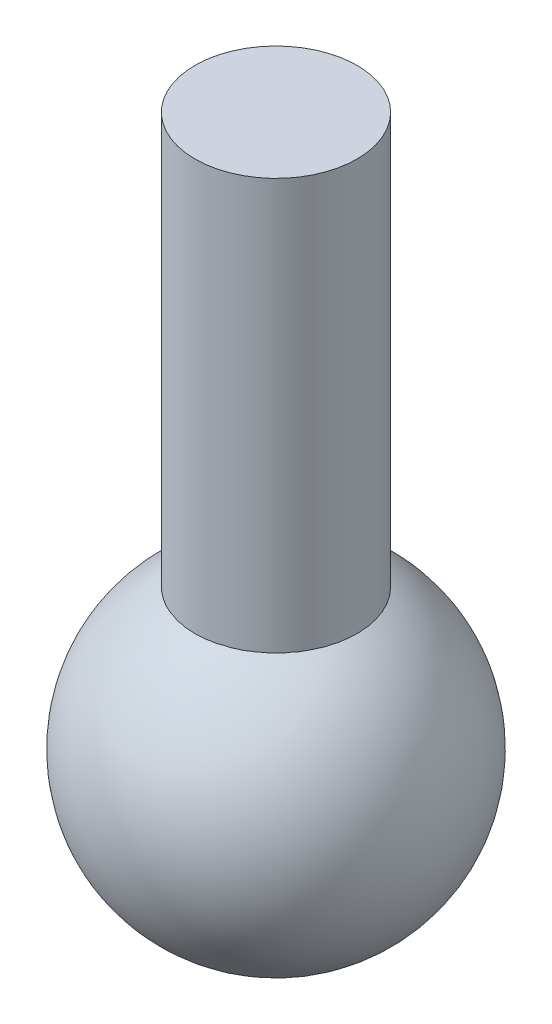
from build123d import *

# Parameters (mm, degrees)
BOSS_EXTRUDE1_DEPTH = 8
SKETCH2_R           = 5
CUT_EXTRUDE1_DEPTH  = 107
CIRPATTERN1_COUNT   = 3
SKETCH6_R           = 5
BOSS_EXTRUDE3_DEPTH = 34
CUT_EXTRUDE2_START  = -10
SKETCH9_R           = 54.22089026
SKETCH9_R_2         = 5
CUT_EXTRUDE2_DEPTH  = 10


with BuildPart() as part:
    # Sketch1 → Boss-Extrude1 (new body)
    with BuildSketch(Plane(origin=(0, 0, 0), x_dir=(1, 0, 0), z_dir=(0, 1, 0))):
        Polygon((-11.547005384, 40), (-40.414518843, -10), (-28.867513459, -30), (28.867513459, -30), (40.414518843, -10), (11.547005384, 40), align=None)
    extrude(amount=BOSS_EXTRUDE1_DEPTH)

    # Sketch2 → Cut-Extrude1 (cut)
    with BuildSketch(Plane(origin=(0, 8, 0), x_dir=(1, 0, 0), z_dir=(0, 1, 0))):
        with Locations(Location((0, 0, 0), (0, 0, 270))):
            Circle(SKETCH2_R)
    extrude(amount=-CUT_EXTRUDE1_DEPTH, mode=Mode.SUBTRACT)


with BuildPart() as cirpattern1_1:
    # CirPattern1: pattern copy
    add(part.part.rotate(Axis((0, 0, 0), (0, 1, 0)), 1 * 360 / CIRPATTERN1_COUNT))


with BuildPart() as cirpattern1_2:
    # CirPattern1: pattern copy
    add(part.part.rotate(Axis((0, 0, 0), (0, 1, 0)), 2 * 360 / CIRPATTERN1_COUNT))


with BuildPart() as part_1:
    add(part.part)

    add(cirpattern1_1.part)  # Boss-Extrude3 merges CirPattern1_1

    add(cirpattern1_2.part)  # Boss-Extrude3 merges CirPattern1_2
    # Sketch6 → Boss-Extrude3 (add)
    with BuildSketch(Plane(origin=(0, 8, 0), x_dir=(1, 0, 0), z_dir=(0, 1, 0))):
        with Locations(Location((0, 0, 0), (0, 0, 270))):
            Circle(SKETCH6_R)
    extrude(amount=-BOSS_EXTRUDE3_DEPTH)

    # Sketch9 → Cut-Extrude2 (cut)
    with BuildSketch(Plane.XZ.offset(CUT_EXTRUDE2_START)):
        Circle(SKETCH9_R)
        with Locations(Location((0, 0, 0), (0, 0, 90))):
            Circle(SKETCH9_R_2, mode=Mode.SUBTRACT)
    extrude(amount=CUT_EXTRUDE2_DEPTH, mode=Mode.SUBTRACT)


with BuildPart() as body_2:
    # Sketch8 → Revolve1 (revolve)
    with BuildSketch(Plane(origin=(0, -26, 0), x_dir=(-1, 0, 0), z_dir=(0, -1, 0))):
        with BuildLine():
            Line((0, 10), (0, -10))
            ThreePointArc((0, -10), (10, 0), (0, 10))
        make_face()
    revolve(axis=Axis((0, -26, 0), (0, 0, -1)))


solid = Compound([part_1.part, body_2.part])
